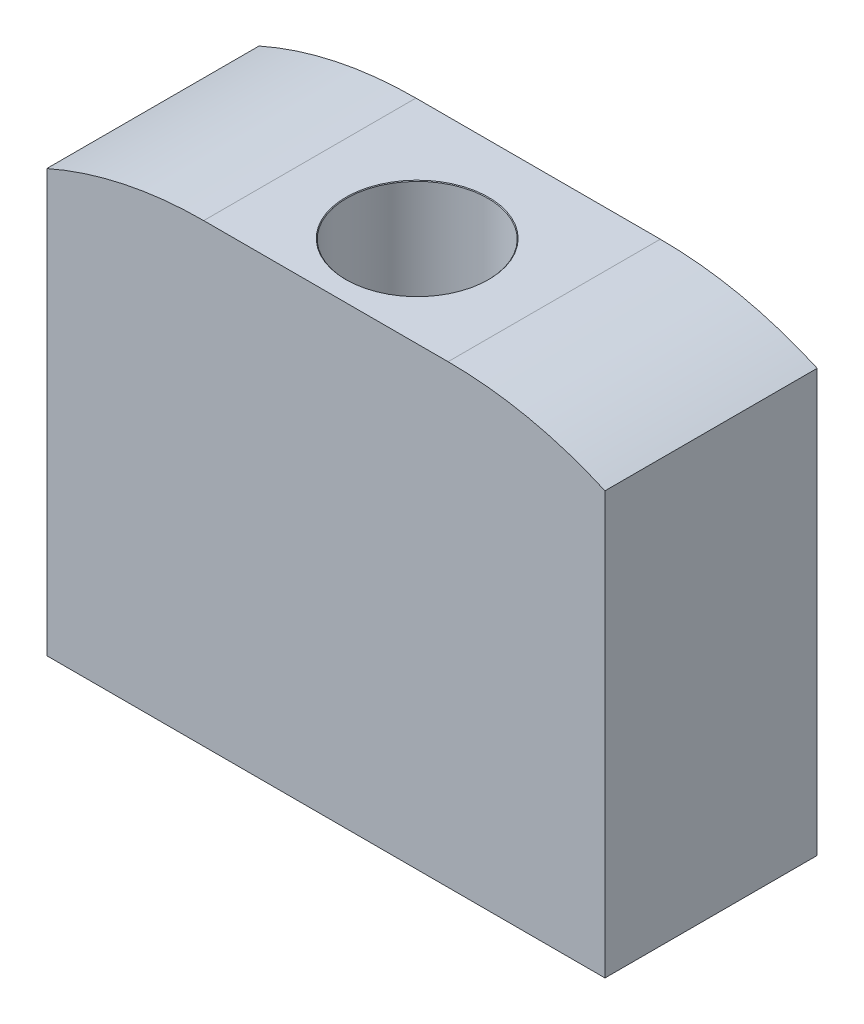
from build123d import *

# Parameters (mm, degrees)
SKETCH1_W           = 21.7
SKETCH1_H           = 17.7
BOSS_EXTRUDE1_DEPTH = 4.125
SKETCH3_OUTSIDE_W   = 29.538
SKETCH3_OUTSIDE_H   = 25.538
CUT_EXTRUDE1_DEPTH  = 8.25


with BuildPart() as part:
    # Sketch1 → Boss-Extrude1 (new, symmetric)
    with BuildSketch(Plane.XY):
        with Locations((0, 8.85)):
            Rectangle(SKETCH1_W, SKETCH1_H)
    extrude(amount=BOSS_EXTRUDE1_DEPTH, both=True)

    # Sketch3 outside → Cut-Extrude1 (cut)
    with BuildSketch(Plane.XY.offset(4.125)):
        with Locations((0, 8.85)):
            Rectangle(SKETCH3_OUTSIDE_W, SKETCH3_OUTSIDE_H)
        with BuildLine():
            Line((-4.75, 17.7), (4.75, 17.7))
            ThreePointArc((4.75, 17.7), (19.75, 2.7), (4.75, -12.3))
            Line((4.75, -12.3), (-4.75, -12.3))
            ThreePointArc((-4.75, -12.3), (-19.75, 2.7), (-4.75, 17.7))
        make_face(mode=Mode.SUBTRACT)
    extrude(amount=-CUT_EXTRUDE1_DEPTH, mode=Mode.SUBTRACT)

    # Sketch5 → CBORE for M2.5 SHCS1 (revolve, cut)
    with BuildSketch(Plane(origin=(0, 17.7, 0.575), x_dir=(0, 0, 1), z_dir=(1, 0, 0))):
        Polygon((0, 0), (0, 17.7), (1.45, 17.7), (1.45, 12.5), (2.75, 12.5), (2.75, 0.025), (2.775, 0), align=None)
    revolve(axis=Axis((0, 24.05, 0.575), (0, -1, 0)), mode=Mode.SUBTRACT)


solid = part.part
